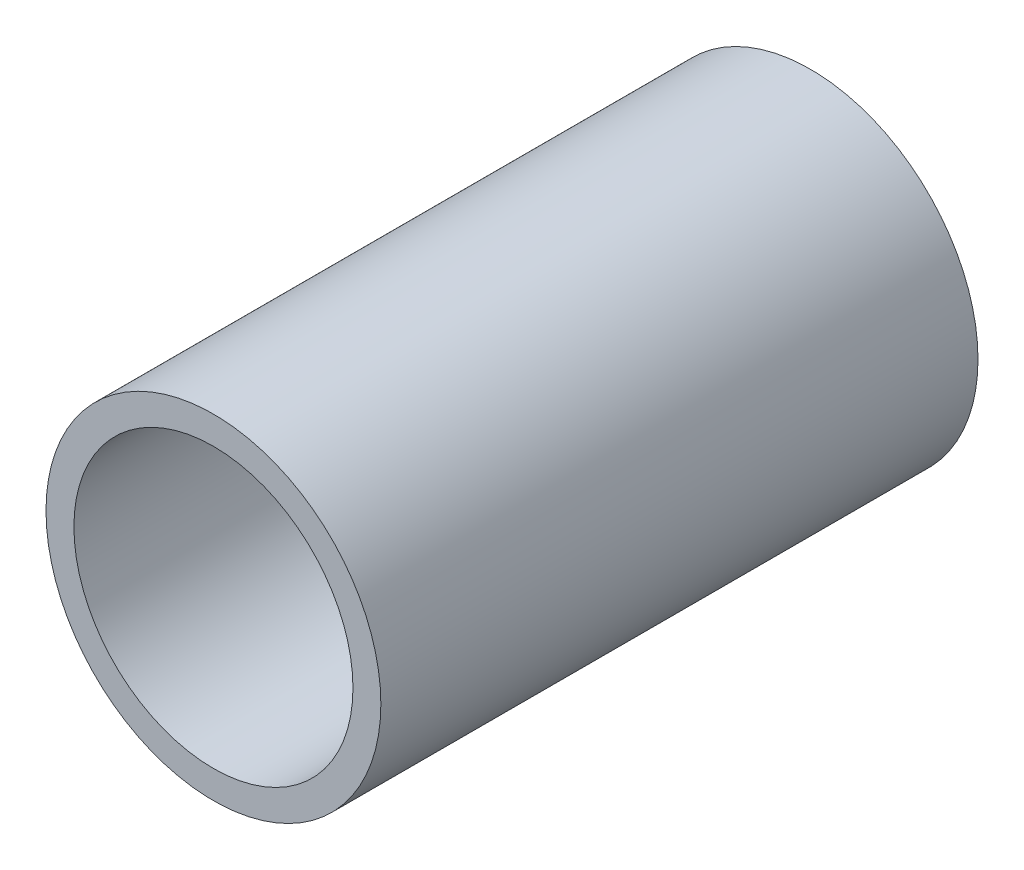
from build123d import *

# Parameters (mm, degrees)
SKETCH1_R           = 6
SKETCH1_R_2         = 5
BOSS_EXTRUDE1_DEPTH = 21.3988


with BuildPart() as part:
    # Sketch1 → Boss-Extrude1 (new body)
    with BuildSketch(Plane.XY):
        Circle(SKETCH1_R)
        Circle(SKETCH1_R_2, mode=Mode.SUBTRACT)
    extrude(amount=-BOSS_EXTRUDE1_DEPTH)


solid = part.part
